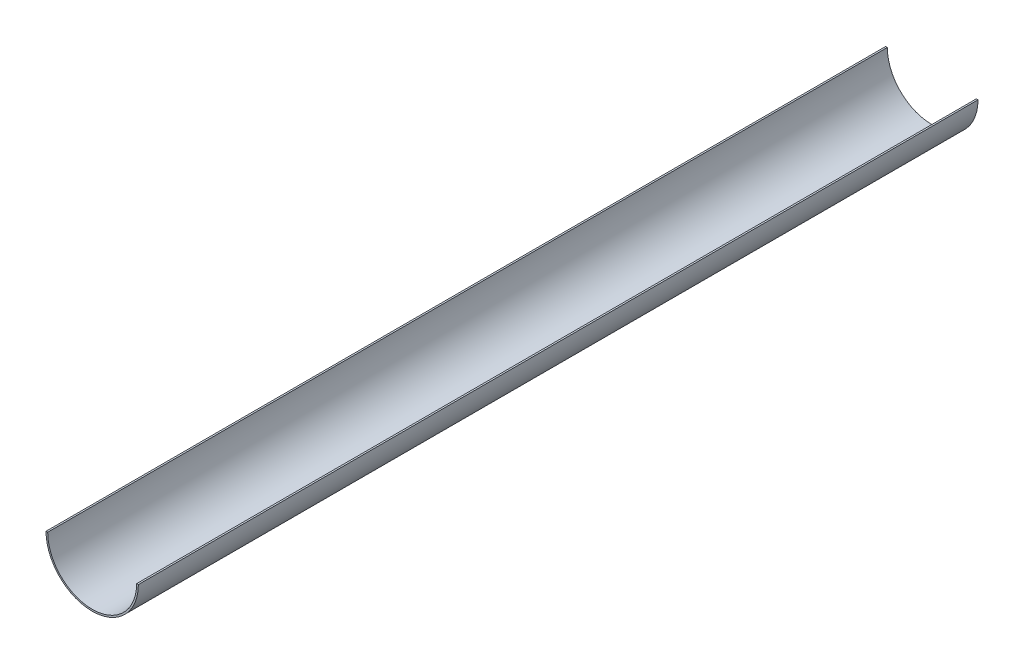
from build123d import *

# Parameters (mm, degrees)
BOSS_EXTRUDE1_DEPTH = 1000


with BuildPart() as part:
    # Sketch1 → Boss-Extrude1 (new body)
    with BuildSketch(Plane.XY):
        with BuildLine():
            Line((-53, 0), (-55, 0))
            ThreePointArc((-55, 0), (0, -55), (55, 0))
            Line((55, 0), (53, 0))
            ThreePointArc((53, 0), (0, -53), (-53, 0))
        make_face()
    extrude(amount=BOSS_EXTRUDE1_DEPTH)


solid = part.part
